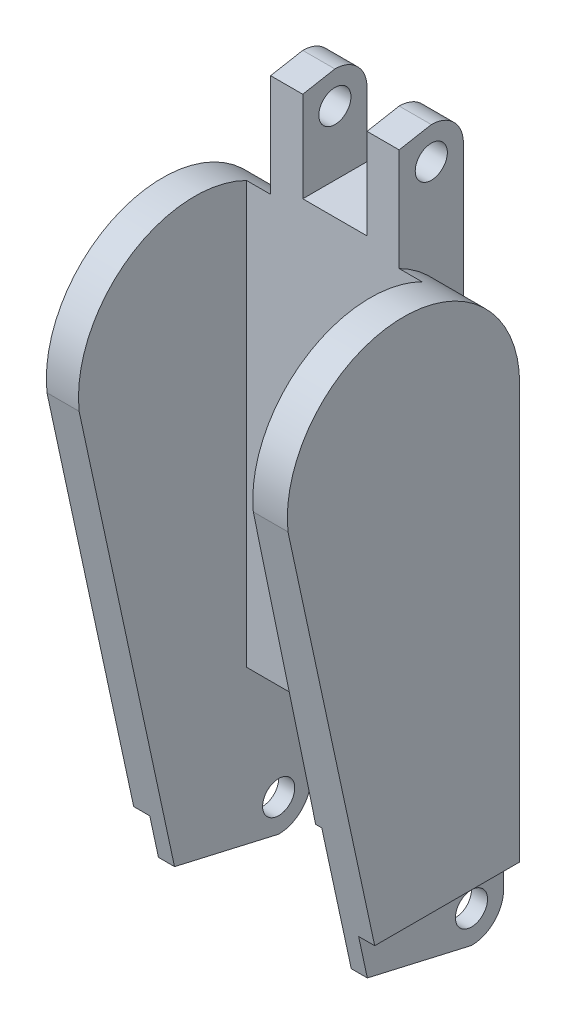
from build123d import *

# Parameters (mm, degrees)
SKETCH2_R                = 2
BOSS_EXTRUDE1_DEPTH      = 30
SKETCH3_W                = 7
SKETCH3_H                = 12
SKETCH3_W_2              = 8
CUT_EXTRUDE1_DEPTH       = 60
CUT_EXTRUDE2_DEPTH       = 42
CUT_EXTRUDE5_DEPTH       = 70
CUT_EXTRUDE9_DEPTH       = 70
CUT_EXTRUDE10_DEPTH      = 7
CUT_EXTRUDE11_DEPTH      = 17
CUT_EXTRUDE11_DEPTH_BACK = 17
SKETCH9_W                = 8
SKETCH9_H                = 2


with BuildPart() as part:
    # Sketch2 → Boss-Extrude1 (new body)
    with BuildSketch(Plane.YZ):
        with BuildLine():
            Line((0, -4), (-78, -4))
            ThreePointArc((-78, -4), (-80.828427125, -2.828427125), (-82, 0))
            Line((-82, 0), (-78.449171497, 15.448029549))
            ThreePointArc((-78.449171497, 15.448029549), (-77.745781061, 16.56461802), (-76.5, 17))
            Line((-76.5, 17), (-5.35, 33.4))
            ThreePointArc((-5.35, 33.4), (-2.521572875, 32.228427125), (-1.35, 29.4))
            Line((-1.35, 29.4), (4, 0))
            ThreePointArc((4, 0), (2.828427125, -2.828427125), (0, -4))
        make_face()
        with Locations(Location((0, 0, 0), (0, 0, 270))):
            Circle(SKETCH2_R, mode=Mode.SUBTRACT)
        with Locations(Location((-78, 0, 0), (0, 0, 270))):
            Circle(SKETCH2_R, mode=Mode.SUBTRACT)
    extrude(amount=BOSS_EXTRUDE1_DEPTH)

    # Sketch3 → Cut-Extrude1 (cut)
    with BuildSketch(Plane(origin=(0, 0, 46), x_dir=(-1, 0, 0), z_dir=(0, 0, -1))):
        Polygon((0, 0), (0, 4), (-7, 4), (-7, -8), (0, -8), align=None)
        with Locations((-26.5, -2)):
            Rectangle(SKETCH3_W, SKETCH3_H)
        with Locations((-15, -2)):
            Rectangle(SKETCH3_W_2, SKETCH3_H)
    extrude(amount=CUT_EXTRUDE1_DEPTH, mode=Mode.SUBTRACT)

    # Sketch4 → Cut-Extrude2 (cut)
    with BuildSketch(Plane(origin=(0, 0, 46), x_dir=(-1, 0, 0), z_dir=(0, 0, -1))):
        Polygon((-15, 3.93673286), (-4, 3.93673286), (-4, -82.06326714), (-25.011555161, -82.06326714), (-26, 3.93673286), align=None)
    extrude(amount=CUT_EXTRUDE2_DEPTH, mode=Mode.SUBTRACT)

    # Sketch6 → Cut-Extrude5 (cut)
    with BuildSketch(Plane(origin=(0, 0, 46), x_dir=(-1, 0, 0), z_dir=(0, 0, -1))):
        Polygon((-15, -62), (-4, -62), (-4, -102), (-26, -102), (-26, -62), align=None)
    extrude(amount=CUT_EXTRUDE5_DEPTH, mode=Mode.SUBTRACT)

    # Sketch7 → Cut-Extrude9 (cut)
    with BuildSketch(Plane(origin=(0, 0, 0), x_dir=(0, -1, 0), z_dir=(-1, 0, 0))):
        with BuildLine():
            Line((8, 28.29), (8, 32.789177793))
            Line((8, 32.789177793), (76.5, 17))
            ThreePointArc((76.5, 17), (77.745781061, 16.56461802), (78.449171497, 15.448029549))
            Line((78.449171497, 15.448029549), (79.020603501, 12.961990453))
            Line((79.020603501, 12.961990453), (8, 28.29))
        make_face()
    extrude(amount=-CUT_EXTRUDE9_DEPTH, mode=Mode.SUBTRACT)

    # Sketch8 → Cut-Extrude10 (cut)
    with BuildSketch(Plane(origin=(0, 0, 0), x_dir=(0, -1, 0), z_dir=(-1, 0, 0))):
        with BuildLine():
            Line((8, 28.29), (25.445762173, 24.608385924))
            ThreePointArc((25.445762173, 24.608385924), (8.078114511, 11.960989597), (22.46, -4))
            Line((22.46, -4), (-8.040982842, -4))
            Line((-8.040982842, -4), (-8.040982842, 32.936104238))
            Line((-8.040982842, 32.936104238), (8, 28.29))
        make_face()
    cut_extrude10 = extrude(amount=-CUT_EXTRUDE10_DEPTH, mode=Mode.SUBTRACT)

    # Mirror1: Cut-Extrude10 across plane
    add(cut_extrude10.mirror(Plane(origin=(15, 0, 0), x_dir=(0, 0, 1), z_dir=(1, 0, 0))), mode=Mode.SUBTRACT)

    # Sketch9 → Cut-Extrude11 (cut, two sides: drawn at the far end of the back side and taken through both)
    with BuildSketch(Plane(origin=(0, 0, 0), x_dir=(0, 1, 0), z_dir=(0, 0, 1)).offset(-CUT_EXTRUDE11_DEPTH_BACK)):
        with Locations((-78, -1)):
            Rectangle(SKETCH9_W, SKETCH9_H)
        with Locations((-78, -29)):
            Rectangle(SKETCH9_W, SKETCH9_H)
    extrude(amount=CUT_EXTRUDE11_DEPTH + CUT_EXTRUDE11_DEPTH_BACK, mode=Mode.SUBTRACT)


solid = part.part
